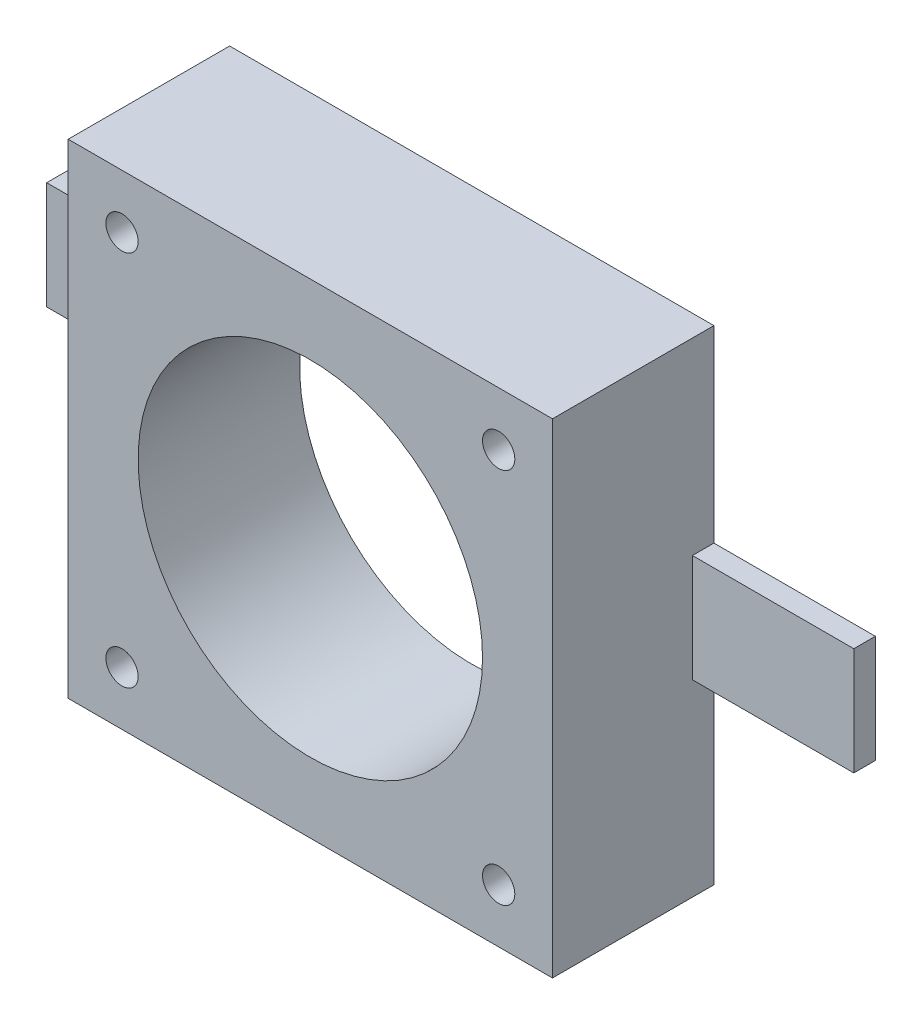
from build123d import *

# Parameters (mm, degrees)
CROQUIS1_W              = 45
CROQUIS1_H              = 45
CROQUIS1_R              = 16
SALIENTE_EXTRUIR1_DEPTH = 15
CROQUIS2_R              = 1.5
CORTAR_EXTRUIR1_DEPTH   = 15
SALIENTE_EXTRUIR2_DEPTH = 15


with BuildPart() as part:
    # Croquis1 → Saliente-Extruir1 (new body)
    with BuildSketch(Plane.XY):
        Rectangle(CROQUIS1_W, CROQUIS1_H)
        Circle(CROQUIS1_R, mode=Mode.SUBTRACT)
    extrude(amount=SALIENTE_EXTRUIR1_DEPTH)

    # Croquis2 → Cortar-Extruir1 (cut)
    with BuildSketch(Plane.XY.offset(15)):
        with Locations((-17.5, 17.5)):
            Circle(CROQUIS2_R)
        with Locations((17.5, -17.5)):
            Circle(CROQUIS2_R)
        with Locations((-17.5, -17.5)):
            Circle(CROQUIS2_R)
        with Locations((17.5, 17.5)):
            Circle(CROQUIS2_R)
    extrude(amount=-CORTAR_EXTRUIR1_DEPTH, mode=Mode.SUBTRACT)

    # Croquis3 → Saliente-Extruir2 (add)
    with BuildSketch(Plane(origin=(22.5, 0, 0), x_dir=(0, 0, -1), z_dir=(1, 0, 0))):
        Polygon((-2, 0), (-2, 5), (0, 5), (0, -5), (-2, -5), align=None)
    saliente_extruir2 = extrude(amount=SALIENTE_EXTRUIR2_DEPTH)

    # Simetría1: Saliente-Extruir2 across plane
    add(saliente_extruir2.mirror(Plane(origin=(0, 0, 0), x_dir=(0, 0, 1), z_dir=(1, 0, 0))))


solid = part.part
